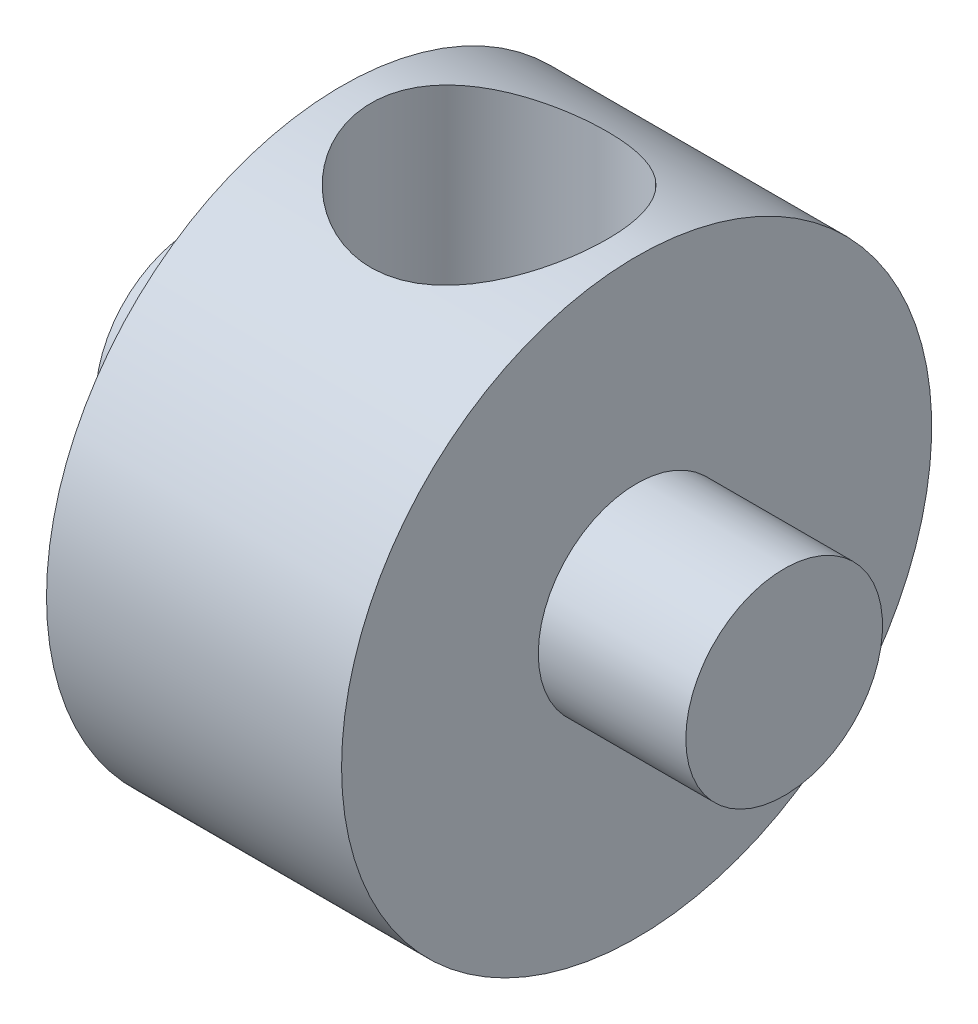
from build123d import *

# Parameters (mm, degrees)
SKETCH1_W               = 4.7625
SKETCH1_H               = 3.175
CUT_EXTRUDE1_DEPTH      = 17.497783942
CUT_EXTRUDE1_DEPTH_BACK = 17.497783942
SKETCH2_R               = 3.81


with BuildPart() as part:
    # Sketch1 → Revolve1 (revolve)
    with BuildSketch(Plane.XY, mode=Mode.PRIVATE) as revolve1_sk:
        Polygon((-4.7625, 0), (0, 0), (0, 9.525), (-4.7625, 9.525), (-4.7625, 3.175), align=None)
        with Locations((7.14375, 1.5875)):
            Rectangle(SKETCH1_W, SKETCH1_H)
        with Locations((-7.14375, 1.5875)):
            Rectangle(SKETCH1_W, SKETCH1_H)
        Polygon((0, 9.525), (0, 0), (4.7625, 0), (4.7625, 3.175), (4.7625, 9.525), align=None)
    revolve(revolve1_sk.sketch.rotate(Axis((-4.7625, 0, 0), (1, 0, 0)), 90), axis=Axis((-4.7625, 0, 0), (1, 0, 0)))

    # Sketch2 → Cut-Extrude1 (cut, two sides: drawn at the far end of the back side and taken through both)
    with BuildSketch(Plane(origin=(0, 0, 0), x_dir=(1, 0, 0), z_dir=(0, 1, 0)).offset(-CUT_EXTRUDE1_DEPTH_BACK)):
        with Locations(Location((0, 0, 0), (0, 0, 270))):
            Circle(SKETCH2_R)
    extrude(amount=CUT_EXTRUDE1_DEPTH + CUT_EXTRUDE1_DEPTH_BACK, mode=Mode.SUBTRACT)


solid = part.part
